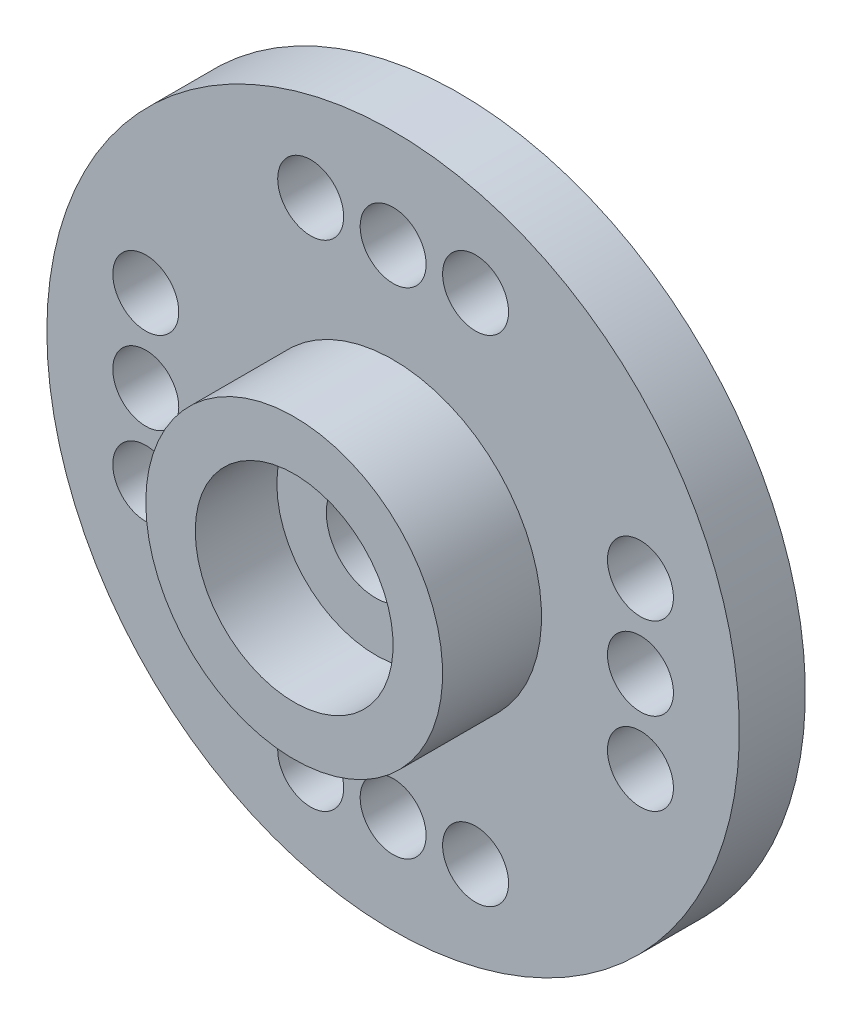
from build123d import *

# Parameters (mm, degrees)
CROQUIS3_R            = 1
CORTAR_EXTRUIR1_DEPTH = 3


with BuildPart() as part:
    # Croquis2 → Revolución1 (revolve)
    with BuildSketch(Plane(origin=(0, 0, 0), x_dir=(0, 0, -1), z_dir=(1, 0, 0)), mode=Mode.PRIVATE) as revoluci_n1_sk:
        Polygon((0, 1.5), (0, 3), (1.5, 3), (1.5, 3.5), (-0.5, 3.5), (-0.5, 4.5), (1, 4.5), (1, 10.5), (-1, 10.5), (-1, 4.5), (-4, 4.5), (-4, 3), (-1.525538697, 3), (-1.525538697, 1.5), align=None)
    revolve(revoluci_n1_sk.sketch.rotate(Axis((0, 0, 0), (0, 0, 1)), 90), axis=Axis((0, 0, 0), (0, 0, 1)))

    # Croquis3 → Cortar-Extruir1 (cut)
    with BuildSketch(Plane(origin=(0, 0, -1), x_dir=(-1, 0, 0), z_dir=(0, 0, -1))):
        with Locations((7.5, 2.5)):
            Circle(CROQUIS3_R)
        with Locations((0, 7.5)):
            Circle(CROQUIS3_R)
        with Locations((7.5, 0)):
            Circle(CROQUIS3_R)
        with Locations((-7.5, 0)):
            Circle(CROQUIS3_R)
        with Locations((0, -7.5)):
            Circle(CROQUIS3_R)
        with Locations((2.5, -7.5)):
            Circle(CROQUIS3_R)
        with Locations((-7.5, -2.5)):
            Circle(CROQUIS3_R)
        with Locations((-2.5, 7.5)):
            Circle(CROQUIS3_R)
        with Locations((7.5, -2.5)):
            Circle(CROQUIS3_R)
        with Locations((-2.5, -7.5)):
            Circle(CROQUIS3_R)
        with Locations((-7.5, 2.5)):
            Circle(CROQUIS3_R)
        with Locations((2.5, 7.5)):
            Circle(CROQUIS3_R)
    extrude(amount=-CORTAR_EXTRUIR1_DEPTH, mode=Mode.SUBTRACT)


solid = part.part
